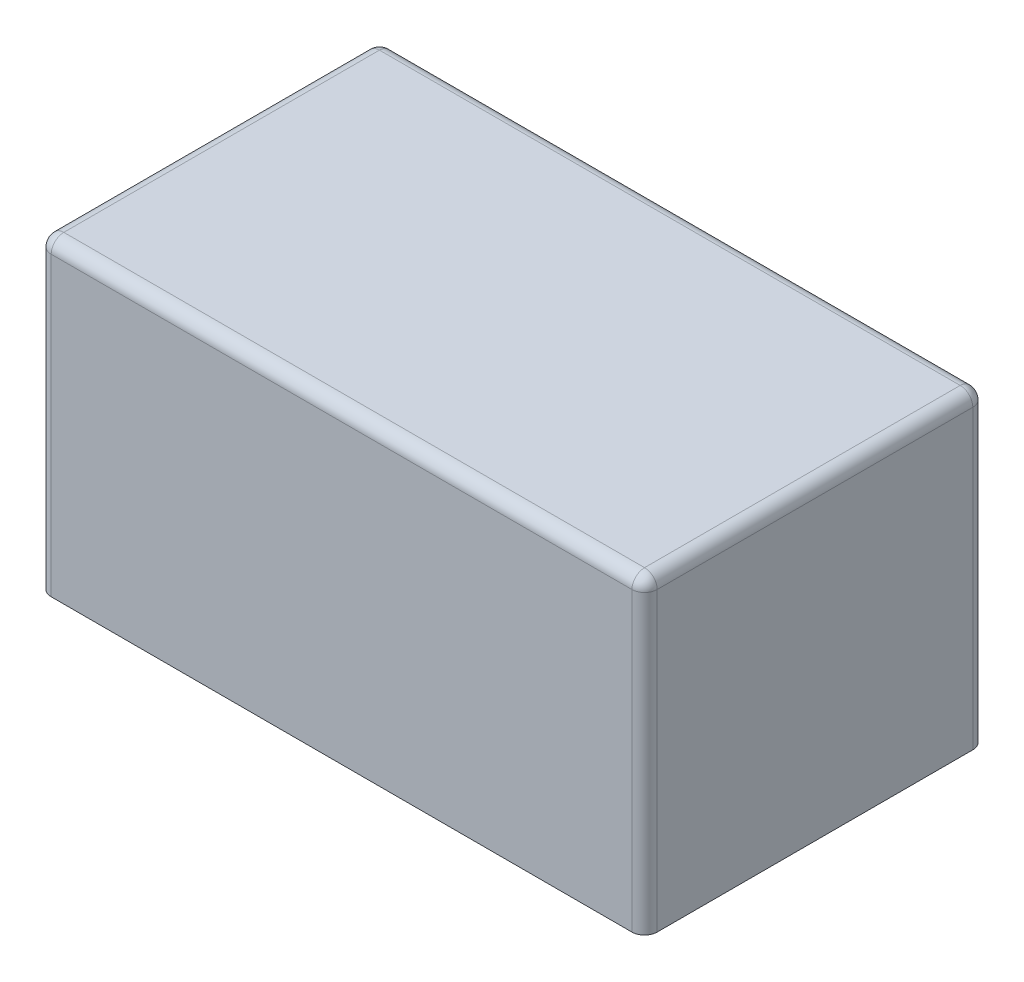
from build123d import *

# Parameters (mm, degrees)
SKETCH_1_W          = 48
SKETCH_1_H          = 27
EXTRUDE_1_DEPTH     = 24.5
FILLET_1_R          = 1
SKETCH_4_W          = 46
SKETCH_4_H          = 25
CUT_EXTRUDE_1_DEPTH = 23.5


with BuildPart() as part:
    # ｽｹｯﾁ1 → ﾎﾞｽ - 押し出し1 (new body)
    with BuildSketch(Plane(origin=(0, 0, 0), x_dir=(1, 0, 0), z_dir=(0, 1, 0))):
        with Locations((-3.851977642, 6.650666667)):
            Rectangle(SKETCH_1_W, SKETCH_1_H)
    extrude(amount=EXTRUDE_1_DEPTH)

    # ﾌｨﾚｯﾄ1
    fillet_1_edges = [part.edges().sort_by_distance(p)[0] for p in [
        (20.148022358, 24.5, -6.650666667),
        (-3.851977642, 24.5, -20.150666667),
        (-27.851977642, 24.5, -6.650666667),
        (-3.851977642, 24.5, 6.849333333),
        (-27.851977642, 12.25, -20.150666667),
        (20.148022358, 12.25, -20.150666667),
        (20.148022358, 12.25, 6.849333333),
        (-27.851977642, 12.25, 6.849333333),
    ]]
    fillet(fillet_1_edges, radius=FILLET_1_R)

    # ｽｹｯﾁ4 → ｶｯﾄ - 押し出し1 (cut)
    with BuildSketch(Plane.XZ):
        with Locations((-3.851977642, -6.650666667)):
            Rectangle(SKETCH_4_W, SKETCH_4_H)
    extrude(amount=-CUT_EXTRUDE_1_DEPTH, mode=Mode.SUBTRACT)


solid = part.part
